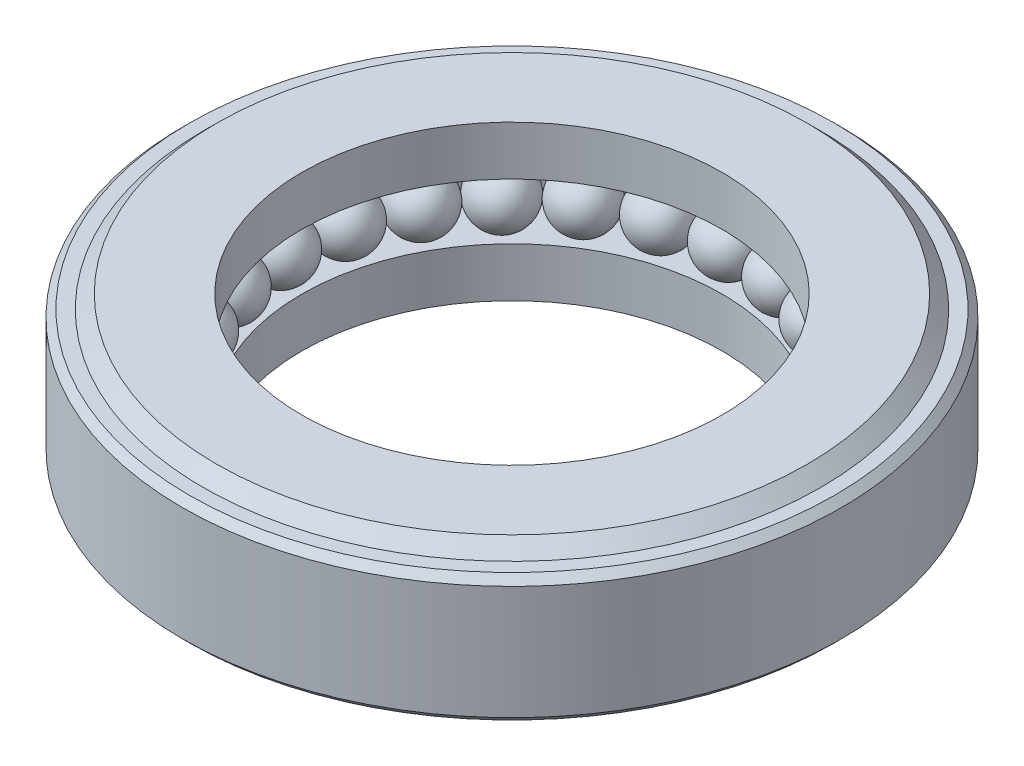
from build123d import *

# Parameters (mm, degrees)
CIRPATTERN1_COUNT = 25
CHAMFER1_SIZE     = 0.063


with BuildPart() as part:
    # Sketch1 → Revolve1 (revolve)
    with BuildSketch(Plane.XY, mode=Mode.PRIVATE) as revolve1_sk:
        Polygon((0, 0), (0.76, 0), (0.88, 0.120021957), (1.065, 0.120021957), (1.065, 1.260021953), (0.88, 1.260021953), (0.76, 1.38), (0, 1.38), (0, 0.940021955), (0.52, 0.940021955), (0.52, 0.440021955), (0, 0.440021955), align=None)
    revolve(revolve1_sk.sketch.rotate(Axis((-1.875, 3.721140014, 0), (0, -1, 0)), 180), axis=Axis((-1.875, 3.721140014, 0), (0, -1, 0)))

    # Sketch2 → Revolve2 (revolve)
    with BuildSketch(Plane.XY):
        with BuildLine():
            Line((-3.939854923, 0.43), (-3.939854923, 0.95))
            ThreePointArc((-3.939854923, 0.95), (-4.199854923, 0.69), (-3.939854923, 0.43))
        make_face()
    revolve2 = revolve(axis=Axis((-3.939854923, 0.43, 0), (0, 1, 0)))

    # CirPattern1: Revolve2 ×25 about axis
    cirpattern1_axis = Axis((-1.875, 0, 0), (0, 1, 0))
    for i in range(1, CIRPATTERN1_COUNT):
        add(revolve2.rotate(cirpattern1_axis, i * 360 / CIRPATTERN1_COUNT))

    # Chamfer1
    chamfer1_edges = [part.edges().sort_by_distance(p)[0] for p in [
        (1.065, 1.260021953, 0),
        (1.065, 0.120021957, 0),
    ]]
    chamfer(chamfer1_edges, length=CHAMFER1_SIZE)


solid = part.part
